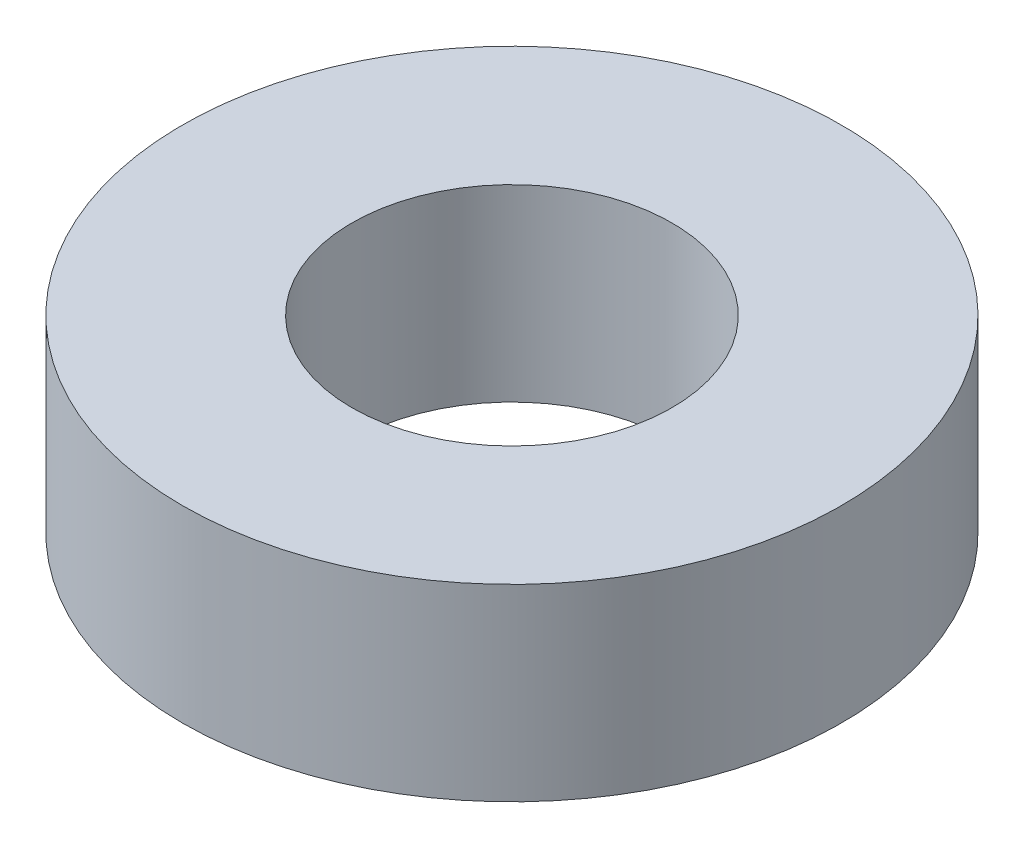
from build123d import *

# Parameters (mm, degrees)
SKETCH1_R           = 17.5
SKETCH1_R_2         = 8.5
BOSS_EXTRUDE1_DEPTH = 10


with BuildPart() as part:
    # Sketch1 → Boss-Extrude1 (new body)
    with BuildSketch(Plane(origin=(0, 0, 0), x_dir=(1, 0, 0), z_dir=(0, 1, 0))):
        with Locations(Location((0, 0, 0), (0, 0, 270))):
            Circle(SKETCH1_R)
        with Locations(Location((0, 0, 0), (0, 0, 270))):
            Circle(SKETCH1_R_2, mode=Mode.SUBTRACT)
    extrude(amount=BOSS_EXTRUDE1_DEPTH)


solid = part.part
